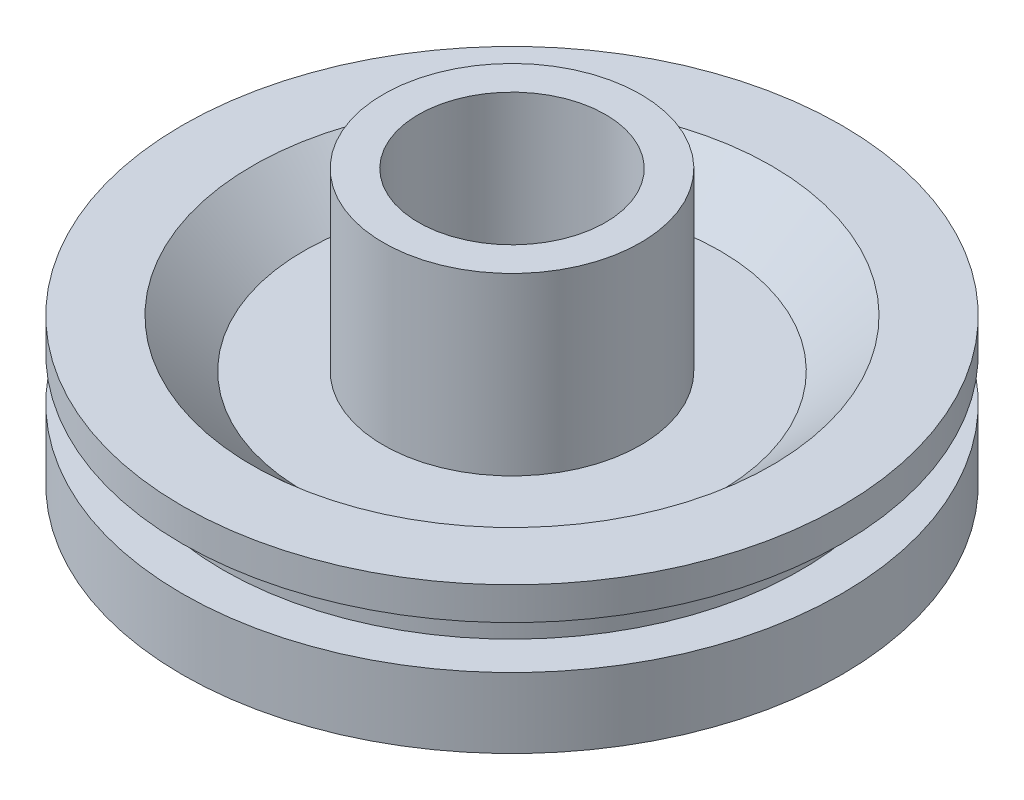
from build123d import *

# Parameters (mm, degrees)
SKETCH2_W          = 8.307416394
SKETCH2_H          = 3.81
SKETCH2_W_2        = 3.81
SKETCH2_H_2        = 8.307416394
CUT_EXTRUDE1_DEPTH = 0.889
CUT_EXTRUDE2_DEPTH = 1.778


with BuildPart() as part:
    # Sketch1 → Revolve1 (revolve)
    with BuildSketch(Plane.XY):
        Polygon((5.08, 14.859), (6.985, 14.859), (6.985, 5.334), (11.303, 5.334), (14.097, 7.9375), (17.907, 7.9375), (17.907, 6.1595), (15.6845, 6.1595), (15.6845, 3.81), (17.907, 3.81), (17.907, 0), (16.002, 0), (16.002, 3.039995698), (11.198857665, 3.039995698), (12.954, 0), (8.9535, 0), (8.9535, -0.889), (4.8895, -0.889), (4.8895, 0), (1.524, 0), (1.524, 5.715), (5.08, 5.715), align=None)
    revolve(axis=Axis((0, 0, 0), (0, 1, 0)))

    # Sketch2 → Cut-Extrude1 (cut)
    with BuildSketch(Plane(origin=(0, -0.889, 0), x_dir=(-1, 0, 0), z_dir=(0, 1, 0))):
        with Locations((6.058708197, 0)):
            Rectangle(SKETCH2_W, SKETCH2_H)
        with Locations((0, 6.058708197)):
            Rectangle(SKETCH2_W_2, SKETCH2_H_2)
        with Locations((0, -6.058708197)):
            Rectangle(SKETCH2_W_2, SKETCH2_H_2)
        with Locations((-6.058708197, 0)):
            Rectangle(SKETCH2_W, SKETCH2_H)
    extrude(amount=CUT_EXTRUDE1_DEPTH, mode=Mode.SUBTRACT)

    # Sketch2<3> → Cut-Extrude2 (cut)
    with BuildSketch(Plane(origin=(0, -0.889, 0), x_dir=(-1, 0, 0), z_dir=(0, 1, 0))):
        with BuildLine():
            ThreePointArc((-0.402826973, 12.988197288), (-0.205131646, 12.64770122), (0.188485038, 12.638378045))
            Line((0.188485038, 12.638378045), (0.813026828, 12.96898322))
            ThreePointArc((0.813026828, 12.96898322), (0.205324805, 12.992820329), (-0.402826973, 12.988197288))
        make_face()
        with BuildLine():
            ThreePointArc((12.988197288, 0.402826973), (12.64770122, 0.205131646), (12.638378045, -0.188485038))
            Line((12.638378045, -0.188485038), (12.96898322, -0.813026828))
            ThreePointArc((12.96898322, -0.813026828), (12.992820329, -0.205324805), (12.988197288, 0.402826973))
        make_face()
        with BuildLine():
            ThreePointArc((0.402826973, -12.988197288), (0.205131646, -12.64770122), (-0.188485038, -12.638378045))
            Line((-0.188485038, -12.638378045), (-0.813026828, -12.96898322))
            ThreePointArc((-0.813026828, -12.96898322), (-0.205324805, -12.992820329), (0.402826973, -12.988197288))
        make_face()
        with BuildLine():
            ThreePointArc((-12.988197288, -0.402826973), (-12.64770122, -0.205131646), (-12.638378045, 0.188485038))
            Line((-12.638378045, 0.188485038), (-12.96898322, 0.813026828))
            ThreePointArc((-12.96898322, 0.813026828), (-12.992820329, 0.205324805), (-12.988197288, -0.402826973))
        make_face()
    extrude(amount=CUT_EXTRUDE2_DEPTH, mode=Mode.SUBTRACT)


solid = part.part
